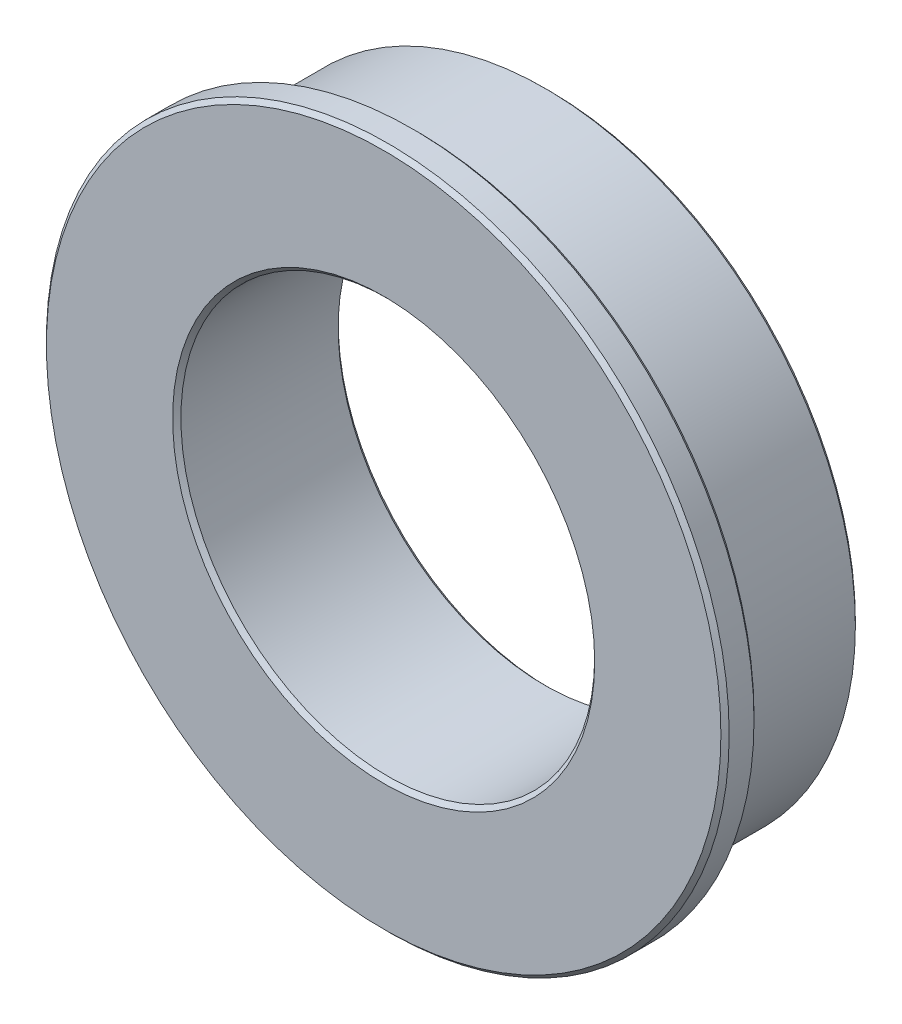
from build123d import *

# Parameters (mm, degrees)
SKETCH_1_R      = 7.5
SKETCH_1_R_2    = 5
EXTRUDE_1_DEPTH = 4
EXTRUDE_START   = -0.8
SKETCH_2_R      = 8.25
SKETCH_2_R_2    = 7.5
EXTRUDE_2_DEPTH = 0.8
CHAMFER_1_SIZE  = 0.1


with BuildPart() as part:
    # 草图1 → 凸台-拉伸1 (new body)
    with BuildSketch(Plane.XY):
        Circle(SKETCH_1_R)
        Circle(SKETCH_1_R_2, mode=Mode.SUBTRACT)
    extrude(amount=EXTRUDE_1_DEPTH)

    # 草图2 → 凸台-拉伸2 (add)
    with BuildSketch(Plane.XY.offset(4).offset(EXTRUDE_START)):
        Circle(SKETCH_2_R)
        Circle(SKETCH_2_R_2, mode=Mode.SUBTRACT)
    extrude(amount=EXTRUDE_2_DEPTH)

    # 倒角1
    chamfer_1_edges = [part.edges().sort_by_distance(p)[0] for p in [
        (-8.25, 0, 3.2),
        (-8.25, 0, 4),
        (-7.5, 0, 0),
        (-5, 0, 0),
        (-5, 0, 4),
    ]]
    chamfer(chamfer_1_edges, length=CHAMFER_1_SIZE)


solid = part.part
